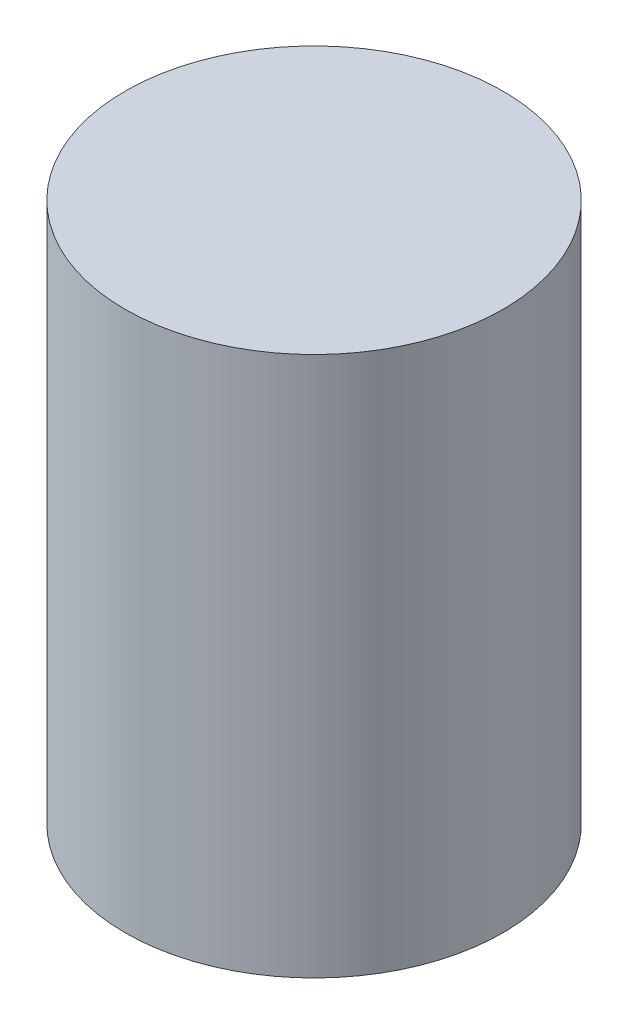
from build123d import *

# Parameters (mm, degrees)
ESQUISSE1_R        = 17.5
BOSS_EXTRU_1_DEPTH = 50


with BuildPart() as part:
    # Esquisse1 → Boss.-Extru.1 (new body)
    with BuildSketch(Plane(origin=(0, 0, 0), x_dir=(1, 0, 0), z_dir=(0, 1, 0))):
        with Locations(Location((0, 0, 0), (0, 0, 270))):
            Circle(ESQUISSE1_R)
    extrude(amount=BOSS_EXTRU_1_DEPTH)


solid = part.part
